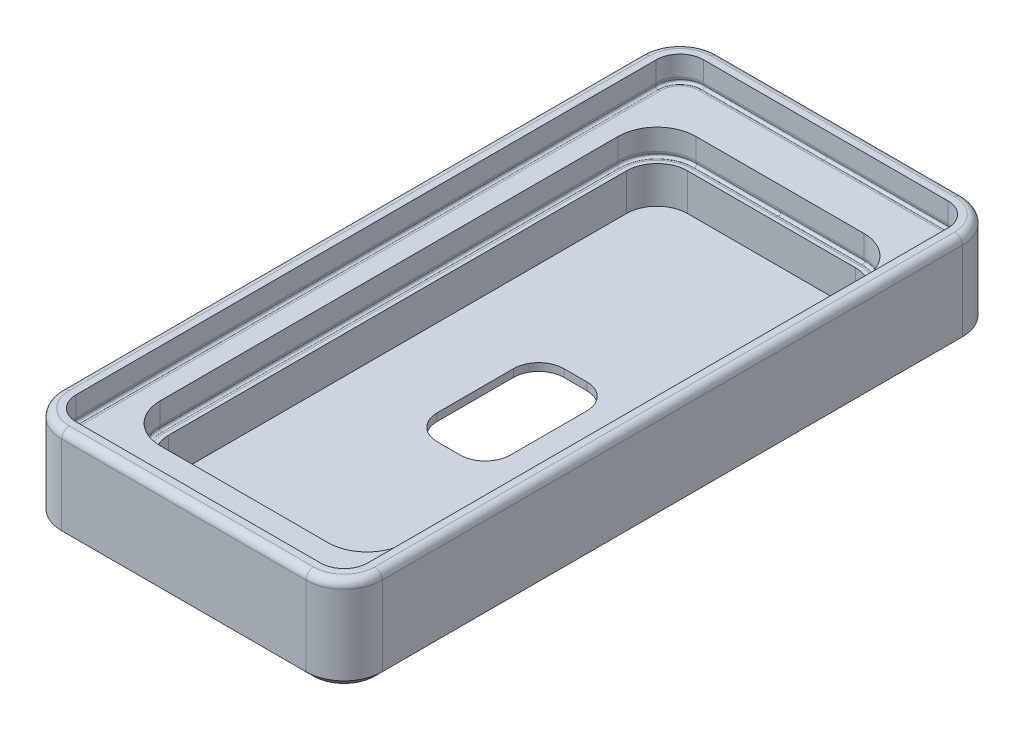
from build123d import *

# Parameters (mm, degrees)
BOSS_EXTRUDE1_DEPTH = 9.2
CUT_EXTRUDE3_DEPTH  = 49.210190831
CUT_EXTRUDE4_DEPTH  = 49.551416045
CUT_EXTRUDE5_DEPTH  = 2
BOSS_EXTRUDE3_DEPTH = 3.2
FILLET3_R           = 1
CUT_EXTRUDE7_DEPTH  = 49.300129399
CUT_EXTRUDE8_DEPTH  = 49.730278062
SKETCH13_R          = 0.25
SKETCH15_R          = 0.25
FILLET4_R           = 0.75
SKETCH17_R          = 3.085
CUT_EXTRUDE9_DEPTH  = 8.2
CHAMFER1_SIZE       = 1


with BuildPart() as part:
    # Sketch1 → Boss-Extrude1 (new body)
    with BuildSketch(Plane(origin=(0, 0, 0), x_dir=(1, 0, 0), z_dir=(0, 1, 0))):
        with BuildLine():
            Line((-16, -43), (16, -43))
            ThreePointArc((16, -43), (19.535533906, -41.535533906), (21, -38))
            Line((21, -38), (21, 38))
            ThreePointArc((21, 38), (19.535533906, 41.535533906), (16, 43))
            Line((16, 43), (-16, 43))
            ThreePointArc((-16, 43), (-19.535533906, 41.535533906), (-21, 38))
            Line((-21, 38), (-21, -38))
            ThreePointArc((-21, -38), (-19.535533906, -41.535533906), (-16, -43))
        make_face()
    extrude(amount=BOSS_EXTRUDE1_DEPTH)

    # Sketch4 → Cut-Extrude3 (cut, through all)
    with BuildSketch(Plane(origin=(0, 5.85, 0), x_dir=(-1, 0, 0), z_dir=(0, -1, 0))):
        with BuildLine():
            Line((-16, -30), (-16, 30))
            ThreePointArc((-16, 30), (-14.535533906, 33.535533906), (-11, 35))
            Line((-11, 35), (11, 35))
            ThreePointArc((11, 35), (14.535533906, 33.535533906), (16, 30))
            Line((16, 30), (16, -30))
            ThreePointArc((16, -30), (14.535533906, -33.535533906), (11, -35))
            Line((11, -35), (-11, -35))
            ThreePointArc((-11, -35), (-14.535533906, -33.535533906), (-16, -30))
        make_face()
    extrude(amount=-CUT_EXTRUDE3_DEPTH, mode=Mode.SUBTRACT)

    # Sketch6 → Cut-Extrude4 (cut, through all)
    with BuildSketch(Plane(origin=(0, 1, 0), x_dir=(1, 0, 0), z_dir=(0, 1, 0))):
        with BuildLine():
            Line((-11, -34), (11, -34))
            ThreePointArc((11, -34), (13.828427125, -32.828427125), (15, -30))
            Line((15, -30), (15, 30))
            ThreePointArc((15, 30), (13.828427125, 32.828427125), (11, 34))
            Line((11, 34), (-11, 34))
            ThreePointArc((-11, 34), (-13.828427125, 32.828427125), (-15, 30))
            Line((-15, 30), (-15, -30))
            ThreePointArc((-15, -30), (-13.828427125, -32.828427125), (-11, -34))
        make_face()
    extrude(amount=CUT_EXTRUDE4_DEPTH, mode=Mode.SUBTRACT)

    # Sketch8 → Cut-Extrude5 (cut)
    with BuildSketch(Plane(origin=(0, 1, 0), x_dir=(1, 0, 0), z_dir=(0, 1, 0))):
        with BuildLine():
            ThreePointArc((4.8, 5), (3.833452378, 7.333452378), (1.5, 8.3))
            Line((1.5, 8.3), (-1.5, 8.3))
            ThreePointArc((-1.5, 8.3), (-3.833452378, 7.333452378), (-4.8, 5))
            Line((-4.8, 5), (-4.8, -5))
            ThreePointArc((-4.8, -5), (-3.833452378, -7.333452378), (-1.5, -8.3))
            Line((-1.5, -8.3), (1.5, -8.3))
            ThreePointArc((1.5, -8.3), (3.833452378, -7.333452378), (4.8, -5))
            Line((4.8, -5), (4.8, 5))
        make_face()
    extrude(amount=-CUT_EXTRUDE5_DEPTH, mode=Mode.SUBTRACT)

    # Sketch9 → Boss-Extrude3 (add)
    with BuildSketch(Plane(origin=(0, 9.2, 0), x_dir=(1, 0, 0), z_dir=(0, 1, 0))):
        with BuildLine():
            Line((-16, -43), (16, -43))
            ThreePointArc((16, -43), (19.535533906, -41.535533906), (21, -38))
            Line((21, -38), (21, 38))
            ThreePointArc((21, 38), (19.535533906, 41.535533906), (16, 43))
            Line((16, 43), (-16, 43))
            ThreePointArc((-16, 43), (-19.535533906, 41.535533906), (-21, 38))
            Line((-21, 38), (-21, -38))
            ThreePointArc((-21, -38), (-19.535533906, -41.535533906), (-16, -43))
        make_face()
        with BuildLine():
            Line((-16, -41), (16, -41))
            ThreePointArc((16, -41), (18.121320344, -40.121320344), (19, -38))
            Line((19, -38), (19, 38))
            ThreePointArc((19, 38), (18.121320344, 40.121320344), (16, 41))
            Line((16, 41), (-16, 41))
            ThreePointArc((-16, 41), (-18.121320344, 40.121320344), (-19, 38))
            Line((-19, 38), (-19, -38))
            ThreePointArc((-19, -38), (-18.121320344, -40.121320344), (-16, -41))
        make_face(mode=Mode.SUBTRACT)
    extrude(amount=BOSS_EXTRUDE3_DEPTH)

    # Fillet3
    fillet3_edges = [part.edges().sort_by_distance(p)[0] for p in [
        (21, 12.4, 0),
        (19.535533906, 12.4, 41.535533906),
        (0, 12.4, 43),
        (-19.535533906, 12.4, 41.535533906),
        (-21, 12.4, 0),
        (-19.535533906, 12.4, -41.535533906),
        (0, 12.4, -43),
        (19.535533906, 12.4, -41.535533906),
    ]]
    fillet(fillet3_edges, radius=FILLET3_R)

    # Sketch11 → Cut-Extrude7 (cut, through all)
    with BuildSketch(Plane(origin=(0, 5.85, 0), x_dir=(1, 0, 0), z_dir=(0, 1, 0))):
        with BuildLine():
            Line((16.1, -30), (16.1, 30))
            ThreePointArc((16.1, 30), (14.606244584, 33.606244584), (11, 35.1))
            Line((11, 35.1), (-11, 35.1))
            ThreePointArc((-11, 35.1), (-14.606244584, 33.606244584), (-16.1, 30))
            Line((-16.1, 30), (-16.1, -30))
            ThreePointArc((-16.1, -30), (-14.606244584, -33.606244584), (-11, -35.1))
            Line((-11, -35.1), (11, -35.1))
            ThreePointArc((11, -35.1), (14.606244584, -33.606244584), (16.1, -30))
        make_face()
        with BuildLine():
            Line((16, -30), (16, 30))
            ThreePointArc((16, 30), (14.535533906, 33.535533906), (11, 35))
            Line((11, 35), (-11, 35))
            ThreePointArc((-11, 35), (-14.535533906, 33.535533906), (-16, 30))
            Line((-16, 30), (-16, -30))
            ThreePointArc((-16, -30), (-14.535533906, -33.535533906), (-11, -35))
            Line((-11, -35), (11, -35))
            ThreePointArc((11, -35), (14.535533906, -33.535533906), (16, -30))
        make_face(mode=Mode.SUBTRACT)
    extrude(amount=CUT_EXTRUDE7_DEPTH, mode=Mode.SUBTRACT)

    # Sketch12 → Cut-Extrude8 (cut, through all)
    with BuildSketch(Plane(origin=(0, 9.2, 0), x_dir=(1, 0, 0), z_dir=(0, 1, 0))):
        with BuildLine():
            Line((-19.1, 38), (-19.1, -38))
            ThreePointArc((-19.1, -38), (-18.192031022, -40.192031022), (-16, -41.1))
            Line((-16, -41.1), (16, -41.1))
            ThreePointArc((16, -41.1), (18.192031022, -40.192031022), (19.1, -38))
            Line((19.1, -38), (19.1, 38))
            ThreePointArc((19.1, 38), (18.192031022, 40.192031022), (16, 41.1))
            Line((16, 41.1), (-16, 41.1))
            ThreePointArc((-16, 41.1), (-18.192031022, 40.192031022), (-19.1, 38))
        make_face()
        with BuildLine():
            Line((-19, 38), (-19, -38))
            ThreePointArc((-19, -38), (-18.121320344, -40.121320344), (-16, -41))
            Line((-16, -41), (16, -41))
            ThreePointArc((16, -41), (18.121320344, -40.121320344), (19, -38))
            Line((19, -38), (19, 38))
            ThreePointArc((19, 38), (18.121320344, 40.121320344), (16, 41))
            Line((16, 41), (-16, 41))
            ThreePointArc((-16, 41), (-18.121320344, 40.121320344), (-19, 38))
        make_face(mode=Mode.SUBTRACT)
    extrude(amount=CUT_EXTRUDE8_DEPTH, mode=Mode.SUBTRACT)

    # Cut-Sweep1: sweep along a path in Sketch14
    with BuildLine(Plane(origin=(0, 9.2, 0), x_dir=(1, 0, 0), z_dir=(0, 1, 0))) as cut_sweep1_path:
        Line((-19.1, 38), (-19.1, -38))
        ThreePointArc((-19.1, -38), (-18.192031022, -40.192031022), (-16, -41.1))
        Line((-16, -41.1), (16, -41.1))
        ThreePointArc((16, -41.1), (18.192031022, -40.192031022), (19.1, -38))
        Line((19.1, -38), (19.1, 38))
        ThreePointArc((19.1, 38), (18.192031022, 40.192031022), (16, 41.1))
        Line((16, 41.1), (-16, 41.1))
        ThreePointArc((-16, 41.1), (-18.192031022, 40.192031022), (-19.1, 38))
    # Sketch13 → Cut-Sweep1 (sweep, cut)
    with BuildSketch(Plane(origin=(0, 0, 0), x_dir=(0, 0, -1), z_dir=(1, 0, 0))):
        with Locations((40.958578644, 9.341421356)):
            Circle(SKETCH13_R)
    sweep(path=cut_sweep1_path.line, mode=Mode.SUBTRACT)

    # Cut-Sweep2: sweep along a path in Sketch16
    with BuildLine(Plane(origin=(0, 5.85, 0), x_dir=(1, 0, 0), z_dir=(0, 1, 0))) as cut_sweep2_path:
        Line((16.1, -30), (16.1, 30))
        ThreePointArc((16.1, 30), (14.606244584, 33.606244584), (11, 35.1))
        Line((11, 35.1), (-11, 35.1))
        ThreePointArc((-11, 35.1), (-14.606244584, 33.606244584), (-16.1, 30))
        Line((-16.1, 30), (-16.1, -30))
        ThreePointArc((-16.1, -30), (-14.606244584, -33.606244584), (-11, -35.1))
        Line((-11, -35.1), (11, -35.1))
        ThreePointArc((11, -35.1), (14.606244584, -33.606244584), (16.1, -30))
    # Sketch15 → Cut-Sweep2 (sweep, cut)
    with BuildSketch(Plane(origin=(0, 0, 0), x_dir=(0, 0, -1), z_dir=(1, 0, 0))):
        with Locations((34.958578644, 5.991421356)):
            Circle(SKETCH15_R)
    sweep(path=cut_sweep2_path.line, mode=Mode.SUBTRACT)

    # Fillet4
    fillet4_edges = [part.edges().sort_by_distance(p)[0] for p in [
        (-18.192031022, 9.547576638, -40.192031022),
        (-19.1, 9.547576638, 0),
        (-18.192031022, 9.547576638, 40.192031022),
        (0, 9.547576638, 41.1),
        (18.192031022, 9.547576638, 40.192031022),
        (19.1, 9.547576638, 0),
        (18.192031022, 9.547576638, -40.192031022),
        (0, 9.547576638, -41.1),
        (-17.946257224, 9.2, -39.946257224),
        (-18.752423362, 9.2, 0),
        (-17.946257224, 9.2, 39.946257224),
        (0, 9.2, 40.752423362),
        (17.946257224, 9.2, 39.946257224),
        (18.752423362, 9.2, 0),
        (17.946257224, 9.2, -39.946257224),
        (0, 9.2, -40.752423362),
        (0, 9.547576638, -41.1),
        (0, 9.2, -40.752423362),
        (-14.360470787, 5.85, -33.360470787),
        (-15.752423362, 5.85, 0),
        (-14.360470787, 5.85, 33.360470787),
        (0, 5.85, 34.752423362),
        (14.360470787, 5.85, 33.360470787),
        (15.752423362, 5.85, 0),
        (14.360470787, 5.85, -33.360470787),
        (0, 5.85, -34.752423362),
        (0, 6.197576638, -35.1),
        (14.606244584, 6.197576638, -33.606244584),
        (16.1, 6.197576638, 0),
        (14.606244584, 6.197576638, 33.606244584),
        (0, 6.197576638, 35.1),
        (-14.606244584, 6.197576638, 33.606244584),
        (-16.1, 6.197576638, 0),
        (-14.606244584, 6.197576638, -33.606244584),
        (0, 5.85, -34.752423362),
        (0, 6.197576638, -35.1),
    ]]
    fillet(fillet4_edges, radius=FILLET4_R)

    # Sketch17 → Cut-Extrude9 (cut)
    with BuildSketch(Plane.XZ):
        with Locations((-16, 38)):
            Circle(SKETCH17_R)
        with Locations((16, 38)):
            Circle(SKETCH17_R)
        with Locations((16, -38)):
            Circle(SKETCH17_R)
        with Locations((-16, -38)):
            Circle(SKETCH17_R)
    extrude(amount=-CUT_EXTRUDE9_DEPTH, mode=Mode.SUBTRACT)

    # Chamfer1
    chamfer1_edges = [part.edges().sort_by_distance(p)[0] for p in [
        (21, 0, 0),
        (19.535533906, 0, -41.535533906),
        (19.535533906, 0, 41.535533906),
        (0, 0, -43),
        (0, 0, 43),
        (-19.535533906, 0, -41.535533906),
        (-19.535533906, 0, 41.535533906),
        (-21, 0, 0),
    ]]
    chamfer(chamfer1_edges, length=CHAMFER1_SIZE)


solid = part.part
